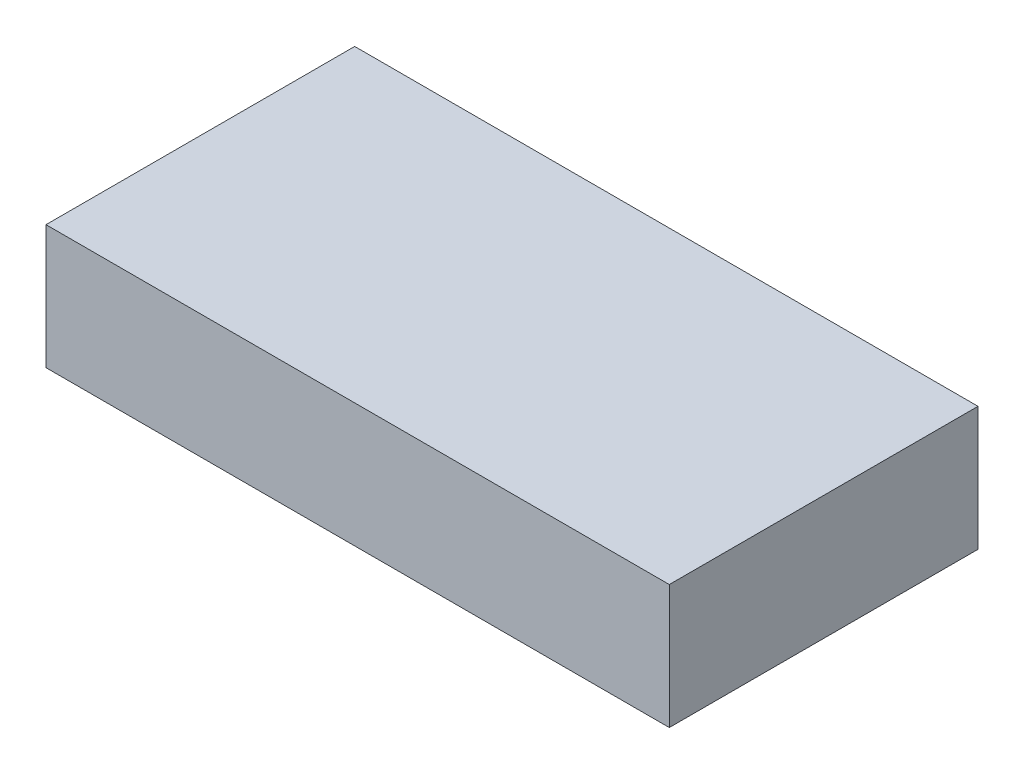
from build123d import *

# Parameters (mm, degrees)
SKETCH1_W           = 15.85
SKETCH1_H           = 7.85
BOSS_EXTRUDE1_DEPTH = 3.15
SHELL1_T            = -1.5


with BuildPart() as part:
    # Sketch1 → Boss-Extrude1 (new body)
    with BuildSketch(Plane(origin=(0, 0, 0), x_dir=(1, 0, 0), z_dir=(0, 1, 0))):
        Rectangle(SKETCH1_W, SKETCH1_H)
    extrude(amount=-BOSS_EXTRUDE1_DEPTH)

    # Shell1
    shell1_openings = [part.faces().sort_by_distance(p)[0] for p in [
        (0, -3.15, 0),
    ]]
    offset(amount=SHELL1_T, openings=shell1_openings, kind=Kind.INTERSECTION)


solid = part.part
